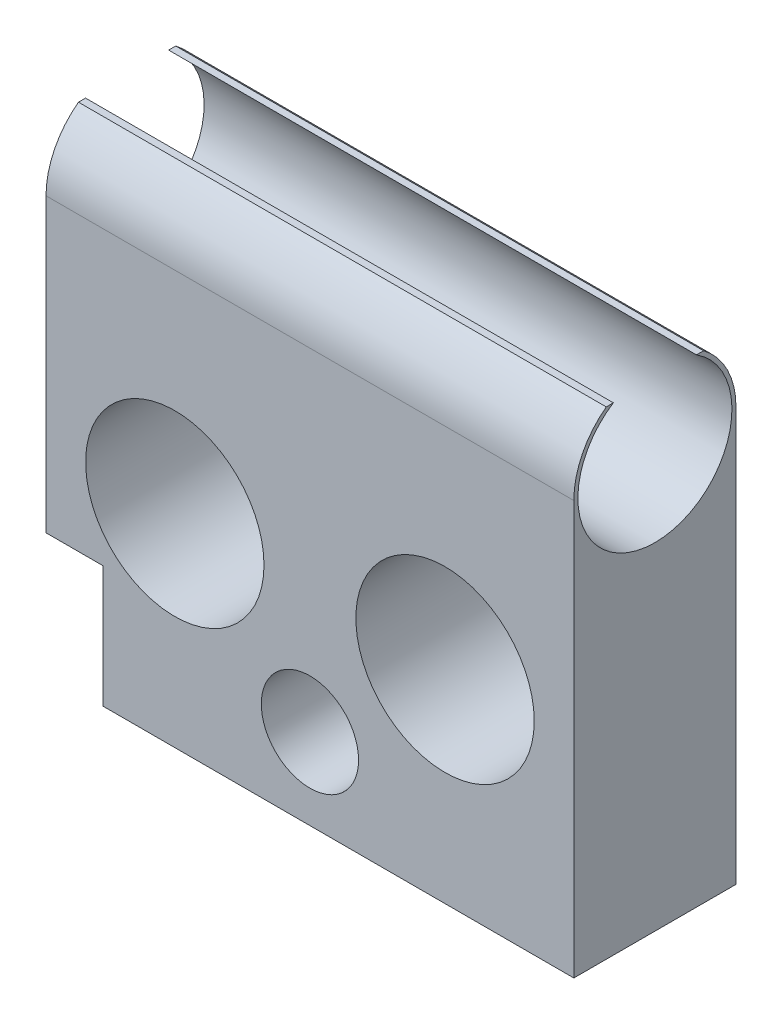
from build123d import *

# Parameters (mm, degrees)
PARALLELEPIPEDOBLOCCO_DEPTH      = 20
SCHIZZO2_R                       = 11
SCHIZZO2_R_2                     = 6
FORITUBIMOTORI_DEPTH             = 54.183667606
SCHIZZO4_R                       = 9.5
FOROLONGHERONE_DEPTH             = 78.504903071
ELIMINAZIONEPARTESUPERIORE_DEPTH = 78.504903071
SCHIZZO6_W                       = 7.05
SCHIZZO6_H                       = 15
SPAZIOMOVIMENTOLEVETTA_DEPTH     = 53.49288047
SCHIZZO7_W                       = 20
SCHIZZO7_H                       = 2
RIMOZIONEPARTESUPERIORE_DEPTH    = 65.1


with BuildPart() as part:
    # Schizzo1 → ParallelepipedoBlocco (new body)
    with BuildSketch(Plane.XY):
        Polygon((-30.55, -25), (30.55, -25), (32.55, -25), (32.55, 17), (32.55, 37), (-32.55, 37), (-32.55, 17), (-32.55, -25), align=None)
    extrude(amount=PARALLELEPIPEDOBLOCCO_DEPTH)

    # Schizzo2 → ForiTubiMotori (cut, through all)
    with BuildSketch(Plane.XY.offset(20)):
        with Locations((-16.665, 0)):
            Circle(SCHIZZO2_R)
        with Locations((16.665, 0)):
            Circle(SCHIZZO2_R)
        with Locations((0, -15)):
            Circle(SCHIZZO2_R_2)
    extrude(amount=-FORITUBIMOTORI_DEPTH, mode=Mode.SUBTRACT)

    # Schizzo4 → ForoLongherone (cut, through all)
    with BuildSketch(Plane.ZY.offset(32.55)):
        with Locations((10, 26)):
            Circle(SCHIZZO4_R)
    extrude(amount=-FOROLONGHERONE_DEPTH, mode=Mode.SUBTRACT)

    # Schizzo5 → EliminazioneParteSuperiore (cut, through all)
    with BuildSketch(Plane.ZY.offset(32.55)):
        with BuildLine():
            Line((0, 26), (0, 37))
            Line((0, 37), (20, 37))
            Line((20, 37), (20, 26))
            ThreePointArc((20, 26), (10, 36), (0, 26))
        make_face()
    extrude(amount=-ELIMINAZIONEPARTESUPERIORE_DEPTH, mode=Mode.SUBTRACT)

    # Schizzo6 → SpazioMovimentoLevetta (cut, through all)
    with BuildSketch(Plane.XY.offset(20)):
        with Locations((-29.025, -17.5)):
            Rectangle(SCHIZZO6_W, SCHIZZO6_H)
    extrude(amount=-SPAZIOMOVIMENTOLEVETTA_DEPTH, mode=Mode.SUBTRACT)

    # Schizzo7 → RimozioneParteSuperiore (cut)
    with BuildSketch(Plane.ZY.offset(32.55)):
        with Locations((10, 35)):
            Rectangle(SCHIZZO7_W, SCHIZZO7_H)
    extrude(amount=-RIMOZIONEPARTESUPERIORE_DEPTH, mode=Mode.SUBTRACT)


solid = part.part
